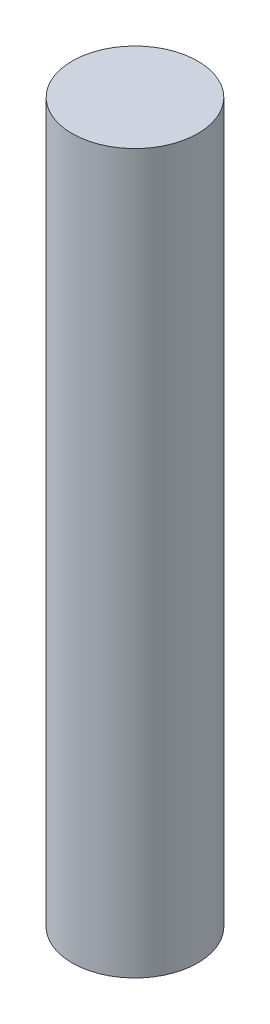
from build123d import *

# Parameters (mm, degrees)
SKETCH1_R           = 5
BOSS_EXTRUDE1_DEPTH = 57.15


with BuildPart() as part:
    # Sketch1 → Boss-Extrude1 (new body)
    with BuildSketch(Plane(origin=(0, 0, 0), x_dir=(1, 0, 0), z_dir=(0, 1, 0))):
        with Locations(Location((0, 0, 0), (0, 0, 270))):
            Circle(SKETCH1_R)
    extrude(amount=BOSS_EXTRUDE1_DEPTH)


solid = part.part
